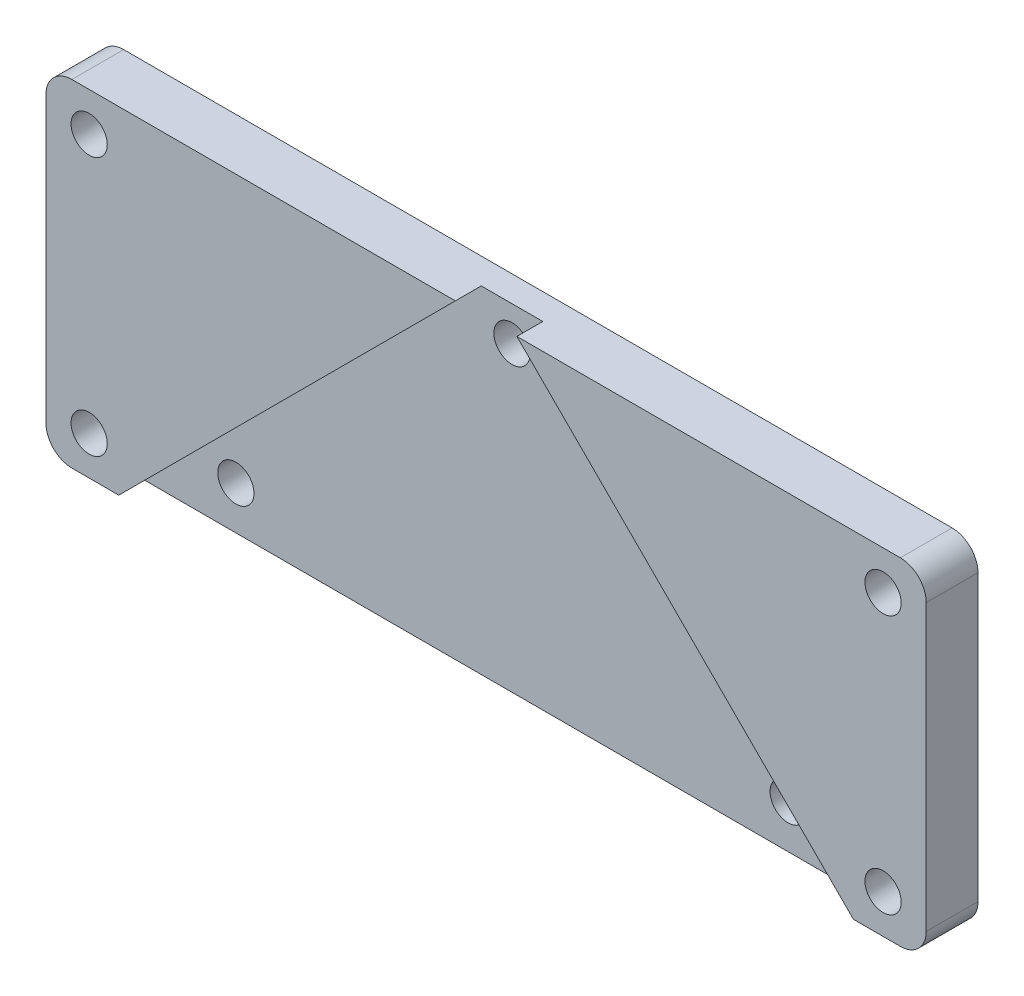
from build123d import *

# Parameters (mm, degrees)
SKETCH_1_R          = 2.1
EXTRUDE_1_DEPTH     = 6
EXTRUDE_START       = -6
SKETCH_2_W          = 102
SKETCH_2_H          = 39
SKETCH_2_R          = 2.1
EXTRUDE_2_DEPTH     = 6
CUT_EXTRUDE_START   = -3
SKETCH_3_R          = 2.1
CUT_EXTRUDE_2_DEPTH = 3
FILLET_1_R          = 3


with BuildPart() as part:
    # 草图1 → 凸台-拉伸1 (new body)
    with BuildSketch(Plane.XY):
        Polygon((-42.425, -5), (42.425, -5), (3.425, 34), (-3.425, 34), align=None)
        with Locations((0, 30)):
            Circle(SKETCH_1_R, mode=Mode.SUBTRACT)
        with Locations((-32, 0)):
            Circle(SKETCH_1_R, mode=Mode.SUBTRACT)
        with Locations((32, 0)):
            Circle(SKETCH_1_R, mode=Mode.SUBTRACT)
    extrude(amount=EXTRUDE_1_DEPTH)

    # 草图2 → 凸台-拉伸2 (add)
    with BuildSketch(Plane.XY.offset(6).offset(EXTRUDE_START)):
        with Locations((0, 14.5)):
            Rectangle(SKETCH_2_W, SKETCH_2_H)
        with Locations((-46, -0.5)):
            Circle(SKETCH_2_R, mode=Mode.SUBTRACT)
        with Locations((-46, 29.5)):
            Circle(SKETCH_2_R, mode=Mode.SUBTRACT)
        with Locations((46, 29.5)):
            Circle(SKETCH_2_R, mode=Mode.SUBTRACT)
        with Locations((46, -0.5)):
            Circle(SKETCH_2_R, mode=Mode.SUBTRACT)
        with Locations((-32, 0)):
            Circle(SKETCH_2_R, mode=Mode.SUBTRACT)
        with Locations((0, 30)):
            Circle(SKETCH_2_R, mode=Mode.SUBTRACT)
        with Locations((32, 0)):
            Circle(SKETCH_2_R, mode=Mode.SUBTRACT)
    extrude(amount=EXTRUDE_2_DEPTH)

    # 草图3 → 切除-拉伸2 (cut)
    with BuildSketch(Plane.XY.offset(6).offset(CUT_EXTRUDE_START)):
        Polygon((-3.425, 34), (-3.566421356, 34), (-42.495710678, -4.929289322), (-42.566421356, -5), (-42.425, -5), (42.425, -5), (42.566421356, -5), (42.495710678, -4.929289322), (3.566421356, 34), (3.425, 34), align=None)
        with Locations((-32, 0)):
            Circle(SKETCH_3_R, mode=Mode.SUBTRACT)
        with Locations((32, 0)):
            Circle(SKETCH_3_R, mode=Mode.SUBTRACT)
        with Locations((0, 30)):
            Circle(SKETCH_3_R, mode=Mode.SUBTRACT)
    extrude(amount=CUT_EXTRUDE_2_DEPTH, mode=Mode.SUBTRACT)

    # 圆角1
    fillet_1_edges = [part.edges().sort_by_distance(p)[0] for p in [
        (-51, 34, 3),
        (51, -5, 3),
        (-51, -5, 3),
        (51, 34, 3),
    ]]
    fillet(fillet_1_edges, radius=FILLET_1_R)


solid = part.part
